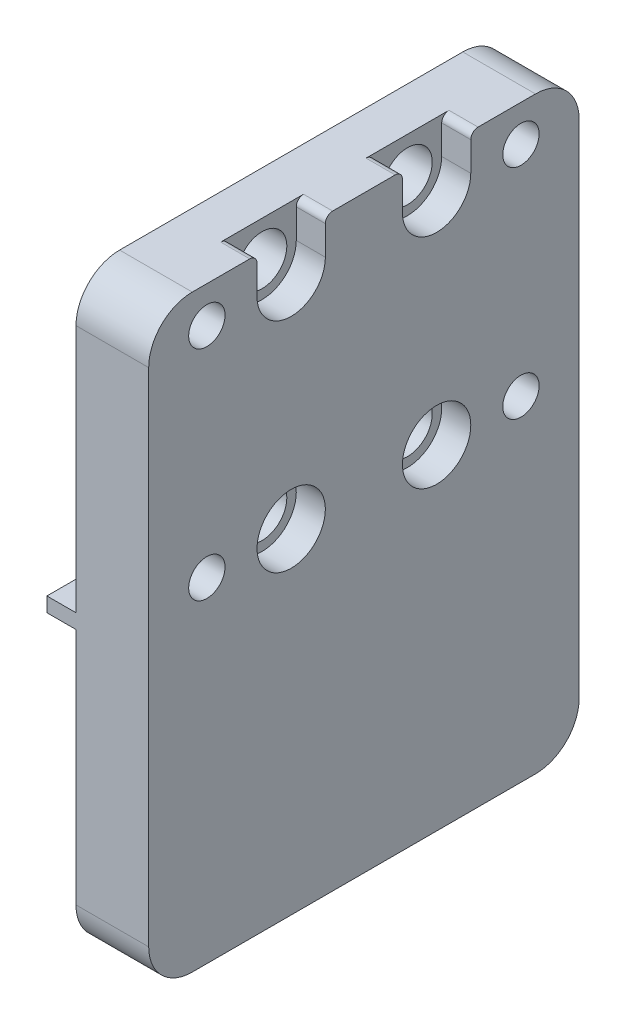
from build123d import *

# Parameters (mm, degrees)
SKETCH_1_W                   = 40.499972991
SKETCH_1_H                   = 29.6
EXTRUDE_1_DEPTH              = 7
SKETCH_2_W                   = 2
SKETCH_2_H                   = 20.10000001
CUT_EXTRUDE_1_DEPTH          = 54.161241934
SKETCH_3_W                   = 2
SKETCH_3_H                   = 19.399972981
CUT_EXTRUDE_2_DEPTH          = 54.161241934
CUT_EXTRUDE_3_DEPTH          = 2
CUT_EXTRUDE_4_DEPTH          = 2
HOLE_WIZARD_2_5_2_5_1_D      = 2.5
HOLE_WIZARD_3_4_3_4_1_D      = 3.4
HOLE_WIZARD_3_4_3_4_1_DEPTH  = 8
HOLE_WIZARD_M3_1_D           = 3.4
HOLE_WIZARD_M3_1_DEPTH       = 10
HOLE_WIZARD_M3_1_CBORE_D     = 4.7
HOLE_WIZARD_M3_1_CBORE_DEPTH = 2
HOLE_WIZARD_M3_2_D           = 3.3
HOLE_WIZARD_M3_2_DEPTH       = 5
HOLE_WIZARD_M3_2_CBORE_D     = 6.1
HOLE_WIZARD_M3_2_CBORE_DEPTH = 1
FILLET_1_R                   = 0.5
FILLET_2_R                   = 3
FILLET_3_R                   = 5


with BuildPart() as part:
    # 草图1 → 凸台-拉伸1 (new body)
    with BuildSketch(Plane(origin=(-7, 0, 0), x_dir=(0, -1, 0), z_dir=(-1, 0, 0))):
        with Locations((23.349986486, 61.611428686)):
            Rectangle(SKETCH_1_W, SKETCH_1_H)
    extrude(amount=-EXTRUDE_1_DEPTH)

    # 草图2 → 切除-拉伸1 (cut, through all)
    with BuildSketch(Plane(origin=(0, 0, 46.811428686), x_dir=(-1, 0, 0), z_dir=(0, 0, -1))):
        with Locations((6, -13.149999995)):
            Rectangle(SKETCH_2_W, SKETCH_2_H)
    extrude(amount=-CUT_EXTRUDE_1_DEPTH, mode=Mode.SUBTRACT)

    # 草图3 → 切除-拉伸2 (cut, through all)
    with BuildSketch(Plane(origin=(0, 0, 46.811428686), x_dir=(-1, 0, 0), z_dir=(0, 0, -1))):
        with Locations((6, -33.89998649)):
            Rectangle(SKETCH_3_W, SKETCH_3_H)
    extrude(amount=-CUT_EXTRUDE_2_DEPTH, mode=Mode.SUBTRACT)

    # 草图4 → 切除-拉伸3 (cut)
    with BuildSketch(Plane(origin=(0, 0, 0), x_dir=(0, 0, -1), z_dir=(1, 0, 0))):
        with BuildLine():
            Line((-58.961428686, -3.09999999), (-58.961428686, -5.6))
            ThreePointArc((-58.961428686, -5.6), (-56.611428686, -7.95), (-54.261428686, -5.6))
            Line((-54.261428686, -5.6), (-54.261428686, -3.09999999))
            Line((-54.261428686, -3.09999999), (-58.961428686, -3.09999999))
        make_face()
    extrude(amount=-CUT_EXTRUDE_3_DEPTH, mode=Mode.SUBTRACT)

    # 草图5 → 切除-拉伸4 (cut)
    with BuildSketch(Plane(origin=(0, 0, 0), x_dir=(0, 0, -1), z_dir=(1, 0, 0))):
        with BuildLine():
            Line((-68.961428686, -3.09999999), (-68.961428686, -5.6))
            ThreePointArc((-68.961428686, -5.6), (-66.611428686, -7.95), (-64.261428686, -5.6))
            Line((-64.261428686, -5.6), (-64.261428686, -3.09999999))
            Line((-64.261428686, -3.09999999), (-68.961428686, -3.09999999))
        make_face()
    extrude(amount=-CUT_EXTRUDE_4_DEPTH, mode=Mode.SUBTRACT)

    # 草图6 → 旋转1 (revolve)
    with BuildSketch(Plane(origin=(0, -31.7, 0), x_dir=(1, 0, 0), z_dir=(0, 1, 0))):
        Polygon((-10, -57.111428686), (-10, -61.611428686), (-5, -61.611428686), (-5, -53.861428686), (-9, -53.861428686), (-9, -57.111428686), align=None)
    revolve(axis=Axis((-10, -31.7, 61.611428686), (1, 0, 0)))

    # Ø2.5 (2.5) 直径孔1 (through all)
    with Locations(Plane.ZY.offset(5)):
        with Locations((72.411428686, -5.599972981), (50.811428686, -20.599972981), (72.411428686, -20.599972981), (50.811428686, -5.599972981)):
            Hole(HOLE_WIZARD_2_5_2_5_1_D / 2)

    # Ø3.4 (3.4) 直径孔1
    with Locations(Plane(origin=(-2, 0, 0), x_dir=(0, 0, -1), z_dir=(1, 0, 0))):
        with Locations((-56.611428686, -5.6), (-66.611428686, -5.6)):
            Hole(HOLE_WIZARD_3_4_3_4_1_D / 2, depth=HOLE_WIZARD_3_4_3_4_1_DEPTH)

    # M3 六角头机械螺钉的柱形沉头孔1
    with Locations(Plane(origin=(0, 0, 0), x_dir=(0, 0, -1), z_dir=(1, 0, 0))):
        with Locations((-56.611428686, -20.6), (-66.611428686, -20.6)):
            CounterBoreHole(HOLE_WIZARD_M3_1_D / 2, HOLE_WIZARD_M3_1_CBORE_D / 2, HOLE_WIZARD_M3_1_CBORE_DEPTH, depth=HOLE_WIZARD_M3_1_DEPTH)

    # M3 六角头机械螺钉的柱形沉头孔2
    with Locations(Plane.ZY.offset(10)):
        with Locations((61.611428686, -31.7)):
            CounterBoreHole(HOLE_WIZARD_M3_2_D / 2, HOLE_WIZARD_M3_2_CBORE_D / 2, HOLE_WIZARD_M3_2_CBORE_DEPTH, depth=HOLE_WIZARD_M3_2_DEPTH)

    # 圆角1
    fillet_1_edges = [part.edges().sort_by_distance(p)[0] for p in [
        (-1, -3.09999999, 58.961428686),
        (-1, -3.09999999, 54.261428686),
        (-1, -3.09999999, 68.961428686),
        (-1, -3.09999999, 64.261428686),
    ]]
    fillet(fillet_1_edges, radius=FILLET_1_R)

    # 圆角2
    fillet_2_edges = [part.edges().sort_by_distance(p)[0] for p in [
        (-2.5, -3.09999999, 76.411428686),
        (-2.5, -43.599972981, 76.411428686),
        (-2.5, -43.599972981, 46.811428686),
        (-2.5, -3.09999999, 46.811428686),
    ]]
    fillet(fillet_2_edges, radius=FILLET_2_R)

    # 圆角3
    fillet_3_edges = [part.edges().sort_by_distance(p)[0] for p in [
        (-6, -24.2, 59.658866267),
        (-6, -24.2, 63.563991105),
    ]]
    fillet(fillet_3_edges, radius=FILLET_3_R)


solid = part.part
